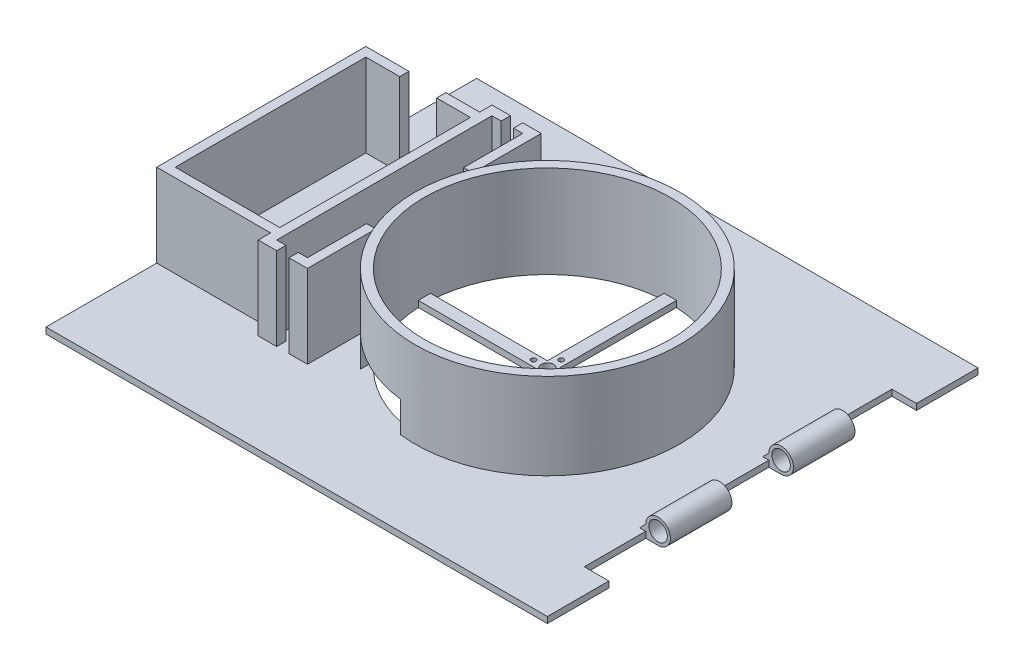
from build123d import *

# Parameters (mm, degrees)
CROQUIS1_R                 = 43
CROQUIS1_R_2               = 40
SALIENTE_EXTRUIR1_DEPTH    = 30
CROQUIS3_R                 = 0.81
CROQUIS3_R_2               = 2
SALIENTE_EXTRUIR2_DEPTH    = 2
CROQUIS4_W                 = 163
CROQUIS4_H                 = 140
CROQUIS4_R                 = 43
SALIENTE_EXTRUIR3_DEPTH    = 2
SALIENTE_EXTRUIR17_DEPTH   = 27
CORTAR_EXTRUIR1_REACH      = 172.731
CORTAR_EXTRUIR1_END_RADIUS = 40
CROQUIS15_W                = 25
CROQUIS15_H                = 10
CROQUIS17_W                = 8
CROQUIS17_H                = 100
CORTAR_EXTRUIR2_DEPTH      = 2
SALIENTE_EXTRUIR19_START   = 20
CROQUIS18_R                = 3
SALIENTE_EXTRUIR19_DEPTH   = 20
MATRIZL2_COUNT             = 2
MATRIZL2_PITCH             = 40


with BuildPart() as part:
    # Croquis1 → Saliente-Extruir1 (new body)
    with BuildSketch(Plane(origin=(0, 0, 0), x_dir=(1, 0, 0), z_dir=(0, 1, 0))):
        with Locations(Location((0, 0, 0), (0, 0, 270))):
            Circle(CROQUIS1_R)
        with Locations(Location((0, 0, 0), (0, 0, 270))):
            Circle(CROQUIS1_R_2, mode=Mode.SUBTRACT)
    extrude(amount=SALIENTE_EXTRUIR1_DEPTH)

    # Croquis3 → Saliente-Extruir2 (add)
    with BuildSketch(Plane(origin=(0, 0, 0), x_dir=(1, 0, 0), z_dir=(0, 1, 0))):
        with BuildLine():
            Line((-2, 39.949968711), (-2, 2))
            Line((-2, 2), (-39.949968711, 2))
            ThreePointArc((-39.949968711, 2), (-40, 0), (-39.949968711, -2))
            Line((-39.949968711, -2), (-2, -2))
            Line((-2, -2), (-2, -39.949968711))
            ThreePointArc((-2, -39.949968711), (0, -40), (2, -39.949968711))
            Line((2, -39.949968711), (2, -2))
            Line((2, -2), (39.949968711, -2))
            ThreePointArc((39.949968711, -2), (39.987490222, -1.000312842), (40, 0))
            ThreePointArc((40, 0), (39.987490222, 1.000312842), (39.949968711, 2))
            Line((39.949968711, 2), (2, 2))
            Line((2, 2), (2, 39.949968711))
            ThreePointArc((2, 39.949968711), (0, 40), (-2, 39.949968711))
        make_face()
        with Locations(Location((0, -4.5, 0), (0, 0, 270))):
            Circle(CROQUIS3_R, mode=Mode.SUBTRACT)
        with Locations(Location((-4.5, 0, 0), (0, 0, 270))):
            Circle(CROQUIS3_R, mode=Mode.SUBTRACT)
        with Locations(Location((0, 0, 0), (0, 0, 270))):
            Circle(CROQUIS3_R_2, mode=Mode.SUBTRACT)
        with Locations(Location((4.5, 0, 0), (0, 0, 270))):
            Circle(CROQUIS3_R, mode=Mode.SUBTRACT)
        with Locations(Location((0, 4.5, 0), (0, 0, 270))):
            Circle(CROQUIS3_R, mode=Mode.SUBTRACT)
    extrude(amount=SALIENTE_EXTRUIR2_DEPTH)

    # Croquis4 → Saliente-Extruir3 (add)
    with BuildSketch(Plane(origin=(0, 0, 0), x_dir=(1, 0, 0), z_dir=(0, 1, 0))):
        with Locations((-11.5, 0)):
            Rectangle(CROQUIS4_W, CROQUIS4_H)
        with Locations(Location((0, 0, 0), (0, 0, 90))):
            Circle(CROQUIS4_R, mode=Mode.SUBTRACT)
    extrude(amount=SALIENTE_EXTRUIR3_DEPTH)

    # Cortar-Extruir1: up to this cylinder (the profile starts outside it)
    cortar_extruir1_end = Plane(origin=(0, 7, 0), z_dir=(0, -1, 0)) * Cylinder(CORTAR_EXTRUIR1_END_RADIUS, 426.462, mode=Mode.PRIVATE)
    # Croquis15 → Cortar-Extruir1 (cut, up to the surface)
    with BuildSketch(Plane.XY.offset(70), mode=Mode.PRIVATE) as cortar_extruir1_sk1:
        with Locations((-17.5, 7)):
            Rectangle(CROQUIS15_W, CROQUIS15_H)
    cortar_extruir1_tool1 = extrude(cortar_extruir1_sk1.sketch, amount=-CORTAR_EXTRUIR1_REACH, mode=Mode.PRIVATE) - cortar_extruir1_end
    add(cortar_extruir1_tool1.solids().sort_by_distance((-17.5, 7, 70))[0], mode=Mode.SUBTRACT)
    # Croquis15 → Cortar-Extruir1 (cut, up to the surface)
    with BuildSketch(Plane.XY.offset(70), mode=Mode.PRIVATE) as cortar_extruir1_sk2:
        with Locations((-17.5, 7)):
            Rectangle(CROQUIS15_W, CROQUIS15_H)
    cortar_extruir1_tool2 = extrude(cortar_extruir1_sk2.sketch, amount=-CORTAR_EXTRUIR1_REACH, mode=Mode.PRIVATE) - cortar_extruir1_end
    add(cortar_extruir1_tool2.solids().sort_by_distance((-17.5, 7, 70))[0], mode=Mode.SUBTRACT)

    # Croquis17 → Cortar-Extruir2 (cut)
    with BuildSketch(Plane(origin=(0, 2, 0), x_dir=(1, 0, 0), z_dir=(0, 1, 0))):
        with Locations((66, 0)):
            Rectangle(CROQUIS17_W, CROQUIS17_H)
    extrude(amount=-CORTAR_EXTRUIR2_DEPTH, mode=Mode.SUBTRACT)

    # Croquis18 → Saliente-Extruir19 (add)
    with BuildSketch(Plane(origin=(0, 0, 50), x_dir=(-1, 0, 0), z_dir=(0, 0, -1)).offset(SALIENTE_EXTRUIR19_START)):
        with BuildLine():
            Line((-62, 0), (-62, 2))
            Line((-62, 2), (-60, 2))
            Line((-60, 2), (-62, 4))
            ThreePointArc((-62, 4), (-68.828427125, 6.828427125), (-66, 0))
            Line((-66, 0), (-62, 0))
        make_face()
        with Locations((-66, 4)):
            Circle(CROQUIS18_R, mode=Mode.SUBTRACT)
    saliente_extruir19 = extrude(amount=SALIENTE_EXTRUIR19_DEPTH)

    # MatrizL2: Saliente-Extruir19 ×2
    with Locations(*[(0, 0, -i * MATRIZL2_PITCH) for i in range(1, MATRIZL2_COUNT)]):
        add(saliente_extruir19)


with BuildPart() as body_2:
    # Croquis14 → Saliente-Extruir17 (new body)
    with BuildSketch(Plane(origin=(0, 2, 0), x_dir=(1, 0, 0), z_dir=(0, 1, 0))):
        Polygon((-93, 34), (-93, -34), (-56, -34), (-56, -31), (-90, -31), (-90, 31), (-79, 31), (-79, 34), align=None)
        Polygon((-56, -31), (-56, -34), (-53, -34), (-53, 34), (-56, 34), (-67, 34), (-67, 31), (-56, 31), align=None)
        Polygon((-53, -34), (-56, -34), (-56, -38), (-50, -38), (-50, -35), (-53, -35), align=None)
        Polygon((-46, -35), (-46, -38), (-40, -38), (-40, -15.779733838), (-43, -15.779733838), (-43, -35), align=None)
        Polygon((-46, 38), (-46, 35), (-43, 35), (-43, 15.779733838), (-40, 15.779733838), (-40, 38), align=None)
        Polygon((-56, 34), (-53, 34), (-53, 35), (-50, 35), (-50, 38), (-56, 38), align=None)
    extrude(amount=SALIENTE_EXTRUIR17_DEPTH)


solid = Compound([part.part, body_2.part])
